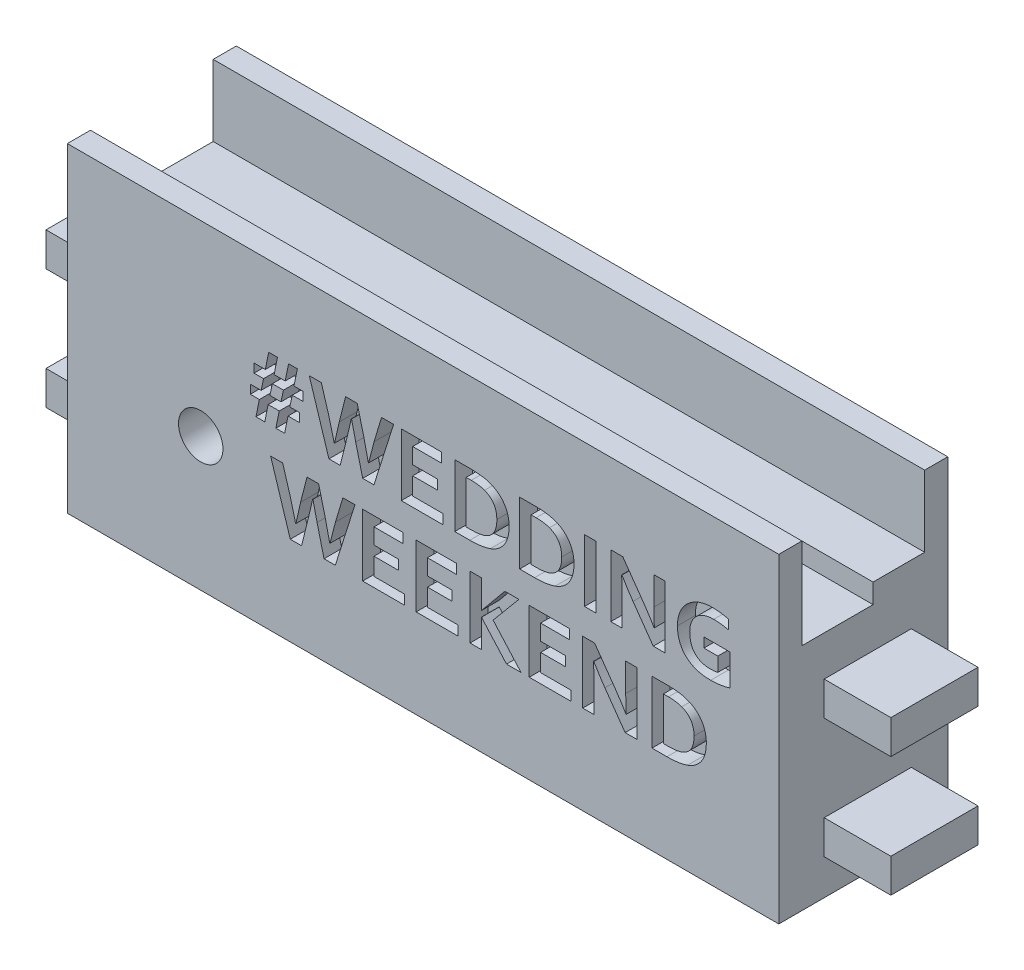
from build123d import *

# Parameters (mm, degrees)
SKETCH1_W              = 101.6
SKETCH1_H              = 35.56
BASE_EXTRUDE_DEPTH     = 24.13
SKETCH2_W              = 12.446
SKETCH2_H              = 4.826
PEG_EXTRUDE_DEPTH      = 9.525
SKETCH3_W              = 101.6
SKETCH3_H              = 3.302
PICTURE_EXTRUDE_DEPTH  = 10.16
SKETCH6_W              = 57.15
SKETCH6_H              = 27.94
SKETCH6_W_2            = 12.7
ELECTRONICS_CUT_DEPTH  = 19.05
SKETCH7_W              = 6.35
SKETCH7_H              = 27.94
BATTERY_WIRE_CUT_DEPTH = 6.35
SWITCH_CUT_REACH       = 123.663
SKETCH8_R              = 3.175
SKETCH9_W              = 3.81
SKETCH9_H              = 6.35
LED_WIRE_CUT_DEPTH     = 12.7
SKETCH10_R             = 1.905
BACK_PLATE_HOLES_DEPTH = 19.05
SKETCH11_W             = 1.627746479
SKETCH11_H             = 8.89
TEXT_CUT_DEPTH         = 2.54
SKETCH12_W             = 101.6
SKETCH12_H             = 10.16
LED_CUT_DEPTH          = 2.794


with BuildPart() as part:
    # Sketch1 → Base Extrude (new body)
    with BuildSketch(Plane.XY):
        with Locations((50.8, 17.78)):
            Rectangle(SKETCH1_W, SKETCH1_H)
    extrude(amount=BASE_EXTRUDE_DEPTH)

    # Sketch2 → Peg Extrude (add)
    with BuildSketch(Plane(origin=(101.6, 0, 0), x_dir=(0, 0, -1), z_dir=(1, 0, 0))):
        with Locations((-11.43, 7.493)):
            Rectangle(SKETCH2_W, SKETCH2_H)
        with Locations((-11.43, 24.638)):
            Rectangle(SKETCH2_W, SKETCH2_H)
    peg_extrude = extrude(amount=PEG_EXTRUDE_DEPTH)

    # Peg Mirror: Peg Extrude across plane
    add(peg_extrude.mirror(Plane(origin=(50.8, 0, 0), x_dir=(0, 0, 1), z_dir=(1, 0, 0))))

    # Sketch3 → Picture Extrude (add)
    with BuildSketch(Plane(origin=(0, 35.56, 0), x_dir=(1, 0, 0), z_dir=(0, 1, 0))):
        with Locations((50.8, -22.479)):
            Rectangle(SKETCH3_W, SKETCH3_H)
        with Locations((50.8, -1.651)):
            Rectangle(SKETCH3_W, SKETCH3_H)
    extrude(amount=PICTURE_EXTRUDE_DEPTH)

    # Sketch6 → Electronics Cut (cut)
    with BuildSketch(Plane(origin=(0, 0, 0), x_dir=(-1, 0, 0), z_dir=(0, 0, -1))):
        with Locations((-60.325, 17.145)):
            Rectangle(SKETCH6_W, SKETCH6_H)
        with Locations((-19.05, 17.145)):
            Rectangle(SKETCH6_W_2, SKETCH6_H)
    extrude(amount=-ELECTRONICS_CUT_DEPTH, mode=Mode.SUBTRACT)

    # Sketch7 → Battery Wire Cut (cut)
    with BuildSketch(Plane(origin=(31.75, 0, 0), x_dir=(0, 0, -1), z_dir=(1, 0, 0))):
        with Locations((-3.175, 17.145)):
            Rectangle(SKETCH7_W, SKETCH7_H)
    extrude(amount=-BATTERY_WIRE_CUT_DEPTH, mode=Mode.SUBTRACT)

    # Sketch8 → Switch Cut (cut, up to next)
    with BuildSketch(Plane(origin=(0, 0, 19.05), x_dir=(-1, 0, 0), z_dir=(0, 0, -1)), mode=Mode.PRIVATE) as switch_cut_sk1:
        with Locations((-19.05, 19.05)):
            Circle(SKETCH8_R)
    switch_cut_tool1 = extrude(switch_cut_sk1.sketch, amount=-SWITCH_CUT_REACH, mode=Mode.PRIVATE) & part.part
    add(switch_cut_tool1.solids().sort_by_distance((19.05, 19.05, 19.05))[0], mode=Mode.SUBTRACT)

    # Sketch9 → LED Wire Cut (cut)
    with BuildSketch(Plane(origin=(0, 35.56, 0), x_dir=(1, 0, 0), z_dir=(0, 1, 0))):
        with Locations((10.795, -17.653)):
            Rectangle(SKETCH9_W, SKETCH9_H)
    extrude(amount=-LED_WIRE_CUT_DEPTH, mode=Mode.SUBTRACT)

    # Sketch10 → Back Plate Holes (cut)
    with BuildSketch(Plane(origin=(0, 0, 0), x_dir=(-1, 0, 0), z_dir=(0, 0, -1))):
        with Locations((-95.25, 22.86)):
            Circle(SKETCH10_R)
        with Locations((-6.35, 22.86)):
            Circle(SKETCH10_R)
    extrude(amount=-BACK_PLATE_HOLES_DEPTH, mode=Mode.SUBTRACT)

    # Sketch11 → Text Cut (cut)
    # profile 1 of 15: a face of its own
    with BuildSketch(Plane.XY.offset(24.13)):
        Polygon((28.272033451, 31.910985915), (28.755270687, 34.29), (30.009339789, 34.29), (29.526102553, 31.910985915), (31.110807658, 31.910985915), (31.594044894, 34.29), (32.848113996, 34.29), (32.366833187, 31.910985915), (33.66003081, 31.910985915), (33.66003081, 30.658873239), (32.114454225, 30.658873239), (31.766210387, 29.031126761), (33.118100792, 29.031126761), (33.118100792, 27.779014085), (31.513831426, 27.779014085), (31.032550616, 25.4), (29.778481514, 25.4), (30.259762324, 27.779014085), (28.675057218, 27.779014085), (28.193776408, 25.4), (26.93775088, 25.4), (27.420988116, 27.779014085), (26.125834067, 27.779014085), (26.125834067, 29.031126761), (27.671410651, 29.031126761), (28.021610915, 30.658873239), (26.667764085, 30.658873239), (26.667764085, 31.910985915), align=None)
        Polygon((28.925479754, 29.031126761), (30.510184859, 29.031126761), (30.860385123, 30.658873239), (29.275680018, 30.658873239), align=None, mode=Mode.SUBTRACT)
    # profile 2 of 15: a face of its own
    with BuildSketch(Plane.XY.offset(24.13)):
        with BuildLine():
            add(Edge.make_bspline(
                [(40.548606954, 31.952070863), (40.459062178, 31.530883449), (40.276556497, 30.672440349), (40.064051291, 29.820923859), (39.955809859, 29.387196303)],
                knots=[0, 0, 0, 0, 0.981282074, 2, 2, 2, 2], degree=3))
            Line((39.955809859, 29.387196303), (38.963901849, 25.4))
            Line((38.963901849, 25.4), (37.353763204, 25.4))
            Line((37.353763204, 25.4), (34.548248239, 34.29))
            Line((34.548248239, 34.29), (36.269903169, 34.29))
            Line((36.269903169, 34.29), (37.334198944, 30.748868838))
            add(Edge.make_bspline(
                [(37.334198944, 30.748868838), (37.411148367, 30.477759151), (37.561094404, 29.949466388), (37.769056066, 29.175770377), (37.951427957, 28.441101025), (38.060109262, 27.963741128), (38.112856514, 27.732059859)],
                knots=[0, 0, 0, 0, 1.085241255, 2.114734843, 3.085007714, 4, 4, 4, 4], degree=3))
            Line((38.112856514, 27.732059859), (38.151985035, 27.732059859))
            add(Edge.make_bspline(
                [(38.151985035, 27.732059859), (38.201400533, 27.974826975), (38.301185712, 28.465048893), (38.466632873, 29.202159359), (38.640317701, 29.949815032), (38.764361907, 30.449688762), (38.826952025, 30.701914613)],
                knots=[0, 0, 0, 0, 0.976034386, 1.970915402, 2.976166265, 4, 4, 4, 4], degree=3))
            Line((38.826952025, 30.701914613), (39.736690141, 34.29))
            Line((39.736690141, 34.29), (41.401608715, 34.29))
            Line((41.401608715, 34.29), (42.313303257, 30.701914613))
            add(Edge.make_bspline(
                [(42.313303257, 30.701914613), (42.436670431, 30.20378983), (42.680738362, 29.218306561), (42.885199908, 28.223853998), (42.98631382, 27.732059859)],
                knots=[0, 0, 0, 0, 1.01092489, 2, 2, 2, 2], degree=3))
            Line((42.98631382, 27.732059859), (43.025442342, 27.732059859))
            add(Edge.make_bspline(
                [(43.025442342, 27.732059859), (43.086635706, 27.994404202), (43.207544224, 28.512755592), (43.399892501, 29.277645717), (43.596566916, 30.021428758), (43.735507753, 30.508441114), (43.804099912, 30.748868838)],
                knots=[0, 0, 0, 0, 1.037391309, 2.04972297, 3.037189381, 4, 4, 4, 4], degree=3))
            Line((43.804099912, 30.748868838), (44.868395687, 34.29))
            Line((44.868395687, 34.29), (46.592007042, 34.29))
            Line((46.592007042, 34.29), (43.784535651, 25.4))
            Line((43.784535651, 25.4), (42.174397007, 25.4))
            Line((42.174397007, 25.4), (41.182488996, 29.387196303))
            add(Edge.make_bspline(
                [(41.182488996, 29.387196303), (41.128168799, 29.608877134), (41.020880976, 30.046718951), (40.865379003, 30.695749771), (40.723064933, 31.329286678), (40.633700472, 31.746573235), (40.589691901, 31.952070863)],
                knots=[0, 0, 0, 0, 1.040356569, 2.054808294, 3.042067674, 4, 4, 4, 4], degree=3))
            Line((40.589691901, 31.952070863), (40.548606954, 31.952070863))
        make_face()
    # profile 3 of 15: a face of its own
    with BuildSketch(Plane.XY.offset(24.13)):
        Polygon((49.315352113, 26.777323944), (53.660574384, 26.777323944), (53.660574384, 25.4), (47.687605634, 25.4), (47.687605634, 34.29), (53.421890405, 34.29), (53.421890405, 32.912676056), (49.315352113, 32.912676056), (49.315352113, 30.658873239), (52.840831866, 30.658873239), (52.840831866, 29.281549296), (49.315352113, 29.281549296), align=None)
    # profile 4 of 15: a face of its own
    with BuildSketch(Plane.XY.offset(24.13)):
        with BuildLine():
            Line((55.325492958, 25.4), (55.325492958, 34.29))
            Line((55.325492958, 34.29), (57.712332746, 34.29))
            add(Edge.make_bspline(
                [(57.712332746, 34.29), (57.818653505, 34.289540009), (58.033369354, 34.288611053), (58.356288005, 34.271657216), (58.677393425, 34.247443495), (58.991691758, 34.211210536), (59.29664915, 34.169200223), (59.589704801, 34.116636732), (59.867421074, 34.056479265), (60.043392058, 34.002893986), (60.128518926, 33.976971831)],
                knots=[0, 0, 0, 0, 1.043593946, 2.10754854, 3.173523578, 4.204294749, 5.212878915, 6.194903184, 7.126775134, 8, 8, 8, 8], degree=3))
            add(Edge.make_bspline(
                [(60.128518926, 33.976971831), (60.245791136, 33.937384116), (60.476019212, 33.859665758), (60.807079277, 33.719215567), (61.114084505, 33.55300963), (61.403152303, 33.371918927), (61.669544262, 33.170202396), (61.913204304, 32.949815332), (62.135463663, 32.713035698), (62.332932524, 32.45720373), (62.510045504, 32.186958349), (62.662532354, 31.900526562), (62.792453027, 31.598779433), (62.899736772, 31.282157667), (62.983940868, 30.950477634), (63.043935839, 30.605164987), (63.082673077, 30.24629877), (63.086597356, 30.002267931), (63.088591549, 29.878259243)],
                knots=[0, 0, 0, 0, 1.089186224, 2.138283641, 3.160292024, 4.158706084, 5.137912795, 6.096978333, 7.047244128, 7.992138446, 8.937782078, 9.887874514, 10.844274186, 11.826235823, 12.827154491, 13.85289531, 14.908909893, 16, 16, 16, 16], degree=3))
            add(Edge.make_bspline(
                [(63.088591549, 29.878259243), (63.086992329, 29.760140691), (63.083849841, 29.528036136), (63.050639285, 29.18513348), (63.001058536, 28.85366959), (62.929913566, 28.533559401), (62.841497906, 28.225209899), (62.726623053, 27.931681136), (62.593888301, 27.650467584), (62.439254439, 27.383749272), (62.261871829, 27.13226347), (62.064174033, 26.894850204), (61.843986948, 26.67326125), (61.602960938, 26.467227964), (61.338458677, 26.278207814), (61.051311074, 26.106723277), (60.740567905, 25.952789673), (60.521824923, 25.86786465), (60.410244278, 25.824544454)],
                knots=[0, 0, 0, 0, 1.086887555, 2.135748769, 3.168058729, 4.170063808, 5.152092151, 6.117449806, 7.067931046, 8.012022167, 8.951272991, 9.89736566, 10.852385093, 11.823139696, 12.812606439, 13.84101728, 14.898704396, 16, 16, 16, 16], degree=3))
            add(Edge.make_bspline(
                [(60.410244278, 25.824544454), (60.31217373, 25.790012137), (60.11080917, 25.719108231), (59.79396908, 25.635006684), (59.45825222, 25.562792778), (59.103269743, 25.50202379), (58.727332948, 25.454583262), (58.328269765, 25.425827232), (57.906956372, 25.401852326), (57.617811128, 25.400627335), (57.469735915, 25.4)],
                knots=[0, 0, 0, 0, 0.835398993, 1.715293255, 2.632340385, 3.594875658, 4.609085711, 5.676420896, 6.810063539, 8, 8, 8, 8], degree=3))
            Line((57.469735915, 25.4), (55.325492958, 25.4))
        make_face()
        with BuildLine():
            add(Edge.make_bspline(
                [(57.630162852, 26.777323944), (57.746915173, 26.778438568), (57.974038036, 26.780606892), (58.305064366, 26.797712437), (58.616404246, 26.829130228), (58.908296141, 26.87178806), (59.180263044, 26.925691319), (59.432203859, 26.993029031), (59.666237558, 27.068960216), (59.811441112, 27.134702392), (59.882009243, 27.166652729)],
                knots=[0, 0, 0, 0, 1.216660131, 2.36681661, 3.452842549, 4.476429291, 5.440052605, 6.340109689, 7.193302415, 8, 8, 8, 8], degree=3))
            add(Edge.make_bspline(
                [(59.882009243, 27.166652729), (59.940643662, 27.19625228), (60.05664863, 27.254813359), (60.21813768, 27.359830281), (60.370974749, 27.472149411), (60.512565289, 27.594169299), (60.643508541, 27.726923156), (60.762037421, 27.869326412), (60.870912292, 28.021488776), (60.96861128, 28.183612878), (61.055147441, 28.357777346), (61.13167101, 28.542395305), (61.193191811, 28.739973326), (61.247405535, 28.947164537), (61.28478959, 29.16730998), (61.314732775, 29.398262493), (61.332399028, 29.641257794), (61.334539532, 29.807147767), (61.335633803, 29.891954225)],
                knots=[0, 0, 0, 0, 0.961643136, 1.902557943, 2.817899626, 3.739205806, 4.637788669, 5.546725084, 6.450827767, 7.376631405, 8.316672613, 9.297862575, 10.30104246, 11.346161031, 12.433195875, 13.569702801, 14.75758074, 16, 16, 16, 16], degree=3))
            add(Edge.make_bspline(
                [(61.335633803, 29.891954225), (61.333931714, 29.980021523), (61.330597999, 30.15251036), (61.310449991, 30.404495754), (61.269981685, 30.642743858), (61.218089533, 30.867871818), (61.150701047, 31.080844363), (61.071428774, 31.282145093), (60.976879442, 31.471179477), (60.86893493, 31.647479397), (60.749160131, 31.812246329), (60.618462147, 31.966226139), (60.471729099, 32.104830376), (60.315573825, 32.23461473), (60.146978051, 32.351769504), (59.967883211, 32.457087361), (59.779959584, 32.554653888), (59.64772029, 32.607890549), (59.58071963, 32.634863556)],
                knots=[0, 0, 0, 0, 1.211129113, 2.372120613, 3.47189722, 4.531188705, 5.546525523, 6.540652967, 7.503134403, 8.448971039, 9.379896832, 10.301969689, 11.221597421, 12.151615773, 13.091952693, 14.040845077, 15.007370132, 16, 16, 16, 16], degree=3))
            add(Edge.make_bspline(
                [(59.58071963, 32.634863556), (59.446596841, 32.67981635), (59.16812447, 32.773149565), (58.798587628, 32.839149204), (58.48235872, 32.877503403), (58.2265586, 32.899188115), (57.95633933, 32.910420206), (57.771687497, 32.911912017), (57.677117077, 32.912676056)],
                knots=[0, 0, 0, 0, 1.315300483, 2.730891928, 3.483105346, 4.281150212, 5.119681927, 6, 6, 6, 6], degree=3))
            Line((57.677117077, 32.912676056), (56.953239437, 32.912676056))
            Line((56.953239437, 32.912676056), (56.953239437, 26.777323944))
            Line((56.953239437, 26.777323944), (57.630162852, 26.777323944))
        make_face(mode=Mode.SUBTRACT)
    # profile 5 of 15: a face of its own
    with BuildSketch(Plane.XY.offset(24.13)):
        with BuildLine():
            Line((64.591126761, 25.4), (64.591126761, 34.29))
            Line((64.591126761, 34.29), (66.977966549, 34.29))
            add(Edge.make_bspline(
                [(66.977966549, 34.29), (67.084287308, 34.289540009), (67.299003156, 34.288611053), (67.621921808, 34.271657216), (67.943027228, 34.247443495), (68.257325561, 34.211210536), (68.562282953, 34.169200223), (68.855338604, 34.116636732), (69.133054877, 34.056479265), (69.309025861, 34.002893986), (69.394152729, 33.976971831)],
                knots=[0, 0, 0, 0, 1.043593946, 2.10754854, 3.173523578, 4.204294749, 5.212878915, 6.194903184, 7.126775134, 8, 8, 8, 8], degree=3))
            add(Edge.make_bspline(
                [(69.394152729, 33.976971831), (69.511424939, 33.937384116), (69.741653015, 33.859665758), (70.07271308, 33.719215567), (70.379718308, 33.55300963), (70.668786106, 33.371918927), (70.935178064, 33.170202396), (71.178838107, 32.949815332), (71.401097466, 32.713035698), (71.598566327, 32.45720373), (71.775679307, 32.186958349), (71.928166157, 31.900526562), (72.05808683, 31.598779433), (72.165370575, 31.282157667), (72.24957467, 30.950477634), (72.309569642, 30.605164987), (72.34830688, 30.24629877), (72.352231159, 30.002267931), (72.354225352, 29.878259243)],
                knots=[0, 0, 0, 0, 1.089186224, 2.138283641, 3.160292024, 4.158706084, 5.137912795, 6.096978333, 7.047244128, 7.992138446, 8.937782078, 9.887874514, 10.844274186, 11.826235823, 12.827154491, 13.85289531, 14.908909893, 16, 16, 16, 16], degree=3))
            add(Edge.make_bspline(
                [(72.354225352, 29.878259243), (72.352626132, 29.760140691), (72.349483644, 29.528036136), (72.316273088, 29.18513348), (72.266692339, 28.85366959), (72.195547369, 28.533559401), (72.107131709, 28.225209899), (71.992256856, 27.931681136), (71.859522104, 27.650467584), (71.704888241, 27.383749272), (71.527505632, 27.13226347), (71.329807836, 26.894850204), (71.109620751, 26.67326125), (70.868594741, 26.467227964), (70.60409248, 26.278207814), (70.316944876, 26.106723277), (70.006201708, 25.952789673), (69.787458726, 25.86786465), (69.675878081, 25.824544454)],
                knots=[0, 0, 0, 0, 1.086887555, 2.135748769, 3.168058729, 4.170063808, 5.152092151, 6.117449806, 7.067931046, 8.012022167, 8.951272991, 9.89736566, 10.852385093, 11.823139696, 12.812606439, 13.84101728, 14.898704396, 16, 16, 16, 16], degree=3))
            add(Edge.make_bspline(
                [(69.675878081, 25.824544454), (69.577807533, 25.790012137), (69.376442973, 25.719108231), (69.059602882, 25.635006684), (68.723886023, 25.562792778), (68.368903545, 25.50202379), (67.99296675, 25.454583262), (67.593903568, 25.425827232), (67.172590174, 25.401852326), (66.88344493, 25.400627335), (66.735369718, 25.4)],
                knots=[0, 0, 0, 0, 0.835398993, 1.715293255, 2.632340385, 3.594875658, 4.609085711, 5.676420896, 6.810063539, 8, 8, 8, 8], degree=3))
            Line((66.735369718, 25.4), (64.591126761, 25.4))
        make_face()
        with BuildLine():
            add(Edge.make_bspline(
                [(66.895796655, 26.777323944), (67.012548976, 26.778438568), (67.239671839, 26.780606892), (67.570698169, 26.797712437), (67.882038049, 26.829130228), (68.173929943, 26.87178806), (68.445896846, 26.925691319), (68.697837662, 26.993029031), (68.931871361, 27.068960216), (69.077074915, 27.134702392), (69.147643046, 27.166652729)],
                knots=[0, 0, 0, 0, 1.216660131, 2.36681661, 3.452842549, 4.476429291, 5.440052605, 6.340109689, 7.193302415, 8, 8, 8, 8], degree=3))
            add(Edge.make_bspline(
                [(69.147643046, 27.166652729), (69.206277465, 27.19625228), (69.322282432, 27.254813359), (69.483771483, 27.359830281), (69.636608551, 27.472149411), (69.778199092, 27.594169299), (69.909142344, 27.726923156), (70.027671224, 27.869326412), (70.136546095, 28.021488776), (70.234245082, 28.183612878), (70.320781243, 28.357777346), (70.397304813, 28.542395305), (70.458825614, 28.739973326), (70.513039338, 28.947164537), (70.550423393, 29.16730998), (70.580366578, 29.398262493), (70.598032831, 29.641257794), (70.600173335, 29.807147767), (70.601267606, 29.891954225)],
                knots=[0, 0, 0, 0, 0.961643136, 1.902557943, 2.817899626, 3.739205806, 4.637788669, 5.546725084, 6.450827767, 7.376631405, 8.316672613, 9.297862575, 10.30104246, 11.346161031, 12.433195875, 13.569702801, 14.75758074, 16, 16, 16, 16], degree=3))
            add(Edge.make_bspline(
                [(70.601267606, 29.891954225), (70.599565517, 29.980021523), (70.596231802, 30.15251036), (70.576083794, 30.404495754), (70.535615488, 30.642743858), (70.483723335, 30.867871818), (70.41633485, 31.080844363), (70.337062577, 31.282145093), (70.242513245, 31.471179477), (70.134568733, 31.647479397), (70.014793934, 31.812246329), (69.88409595, 31.966226139), (69.737362902, 32.104830376), (69.581207628, 32.23461473), (69.412611854, 32.351769504), (69.233517014, 32.457087361), (69.045593387, 32.554653888), (68.913354093, 32.607890549), (68.846353433, 32.634863556)],
                knots=[0, 0, 0, 0, 1.211129113, 2.372120613, 3.47189722, 4.531188705, 5.546525523, 6.540652967, 7.503134403, 8.448971039, 9.379896832, 10.301969689, 11.221597421, 12.151615773, 13.091952693, 14.040845077, 15.007370132, 16, 16, 16, 16], degree=3))
            add(Edge.make_bspline(
                [(68.846353433, 32.634863556), (68.712230643, 32.67981635), (68.433758272, 32.773149565), (68.064221431, 32.839149204), (67.747992523, 32.877503403), (67.492192402, 32.899188115), (67.221973132, 32.910420206), (67.0373213, 32.911912017), (66.94275088, 32.912676056)],
                knots=[0, 0, 0, 0, 1.315300483, 2.730891928, 3.483105346, 4.281150212, 5.119681927, 6, 6, 6, 6], degree=3))
            Line((66.94275088, 32.912676056), (66.218873239, 32.912676056))
            Line((66.218873239, 32.912676056), (66.218873239, 26.777323944))
            Line((66.218873239, 26.777323944), (66.895796655, 26.777323944))
        make_face(mode=Mode.SUBTRACT)
    # profile 6 of 15: a face of its own
    with BuildSketch(Plane.XY.offset(24.13)):
        with Locations((74.670633803, 29.845)):
            Rectangle(SKETCH11_W, SKETCH11_H)
    # profile 7 of 15: a face of its own
    with BuildSketch(Plane.XY.offset(24.13)):
        with BuildLine():
            add(Edge.make_bspline(
                [(82.236133363, 30.156071743), (82.313707535, 30.043883995), (82.465971125, 29.823680429), (82.690766249, 29.499667215), (82.899037699, 29.181753797), (83.098682053, 28.874656292), (83.289084823, 28.578461272), (83.465136867, 28.289344145), (83.631124027, 28.011050988), (83.736314564, 27.827421204), (83.787579225, 27.737929137)],
                knots=[0, 0, 0, 0, 1.13896322, 2.235571772, 3.292817263, 4.312366223, 5.294281487, 6.232900844, 7.138803343, 8, 8, 8, 8], degree=3))
            Line((83.787579225, 27.737929137), (83.826707746, 27.737929137))
            add(Edge.make_bspline(
                [(83.826707746, 27.737929137), (83.820789531, 27.877485433), (83.809368348, 28.146806158), (83.79364975, 28.536133811), (83.780153297, 28.896122827), (83.76758645, 29.226715761), (83.760322807, 29.528047706), (83.754310204, 29.799336527), (83.750161864, 30.041283772), (83.748997655, 30.192590498), (83.748450704, 30.263675176)],
                knots=[0, 0, 0, 0, 1.326562248, 2.560047207, 3.700459796, 4.747806249, 5.701913724, 6.562998787, 7.324889438, 8, 8, 8, 8], degree=3))
            Line((83.748450704, 30.263675176), (83.748450704, 34.29))
            Line((83.748450704, 34.29), (85.376197183, 34.29))
            Line((85.376197183, 34.29), (85.376197183, 25.4))
            Line((85.376197183, 25.4), (83.672150088, 25.4))
            Line((83.672150088, 25.4), (80.780552377, 29.49284331))
            add(Edge.make_bspline(
                [(80.780552377, 29.49284331), (80.65087482, 29.675925448), (80.38370492, 30.053122843), (79.995734797, 30.650387217), (79.596207147, 31.287307148), (79.335607655, 31.730325608), (79.201716549, 31.957940141)],
                knots=[0, 0, 0, 0, 0.919269384, 1.893936901, 2.917944486, 4, 4, 4, 4], degree=3))
            Line((79.201716549, 31.957940141), (79.160631602, 31.957940141))
            add(Edge.make_bspline(
                [(79.160631602, 31.957940141), (79.16739658, 31.825566575), (79.1805245, 31.568686255), (79.195613625, 31.194949655), (79.209326252, 30.844099553), (79.221791005, 30.516109956), (79.229042885, 30.210864259), (79.235083192, 29.929140974), (79.239178664, 29.670236446), (79.240305954, 29.505235162), (79.24084507, 29.426324824)],
                knots=[0, 0, 0, 0, 1.255808074, 2.436984887, 3.543827291, 4.582519822, 5.546722309, 6.436656003, 7.252345191, 8, 8, 8, 8], degree=3))
            Line((79.24084507, 29.426324824), (79.24084507, 25.4))
            Line((79.24084507, 25.4), (77.613098592, 25.4))
            Line((77.613098592, 25.4), (77.613098592, 34.29))
            Line((77.613098592, 34.29), (79.317145687, 34.29))
            Line((79.317145687, 34.29), (82.236133363, 30.156071743))
        make_face()
    # profile 8 of 15: a face of its own
    with BuildSketch(Plane.XY.offset(24.13)):
        with BuildLine():
            Line((92.888873239, 28.780704225), (90.90897007, 28.780704225))
            Line((90.90897007, 28.780704225), (90.90897007, 30.158028169))
            Line((90.90897007, 30.158028169), (94.641830986, 30.158028169))
            Line((94.641830986, 30.158028169), (94.641830986, 25.709115317))
            add(Edge.make_bspline(
                [(94.641830986, 25.709115317), (94.567045756, 25.683664878), (94.400573047, 25.627011932), (94.123828784, 25.550802171), (93.800850779, 25.47702105), (93.442261231, 25.412628528), (93.05992699, 25.356315193), (92.665284286, 25.311497716), (92.266565426, 25.280398947), (92.000060453, 25.276651202), (91.867618838, 25.274788732)],
                knots=[0, 0, 0, 0, 0.672392139, 1.496751972, 2.442164542, 3.4918823, 4.597344684, 5.731540891, 6.872672486, 8, 8, 8, 8], degree=3))
            add(Edge.make_bspline(
                [(91.867618838, 25.274788732), (91.675716136, 25.278145248), (91.30263185, 25.28467076), (90.76211955, 25.346440874), (90.258413993, 25.444951281), (89.792821628, 25.583146667), (89.365586498, 25.760689222), (88.974837181, 25.969295714), (88.620868353, 26.211798068), (88.304981591, 26.486678088), (88.025450965, 26.79082394), (87.785018204, 27.125098662), (87.581234917, 27.486051188), (87.41467348, 27.873829469), (87.28499452, 28.285439272), (87.197934151, 28.719848765), (87.137412727, 29.173555516), (87.131943432, 29.483504961), (87.12915493, 29.64153169)],
                knots=[0, 0, 0, 0, 1.259439321, 2.448516959, 3.566075659, 4.625305067, 5.631089946, 6.598424526, 7.528272133, 8.441722042, 9.341708401, 10.234086166, 11.138977727, 12.057560289, 12.999997922, 13.966450983, 14.96320156, 16, 16, 16, 16], degree=3))
            add(Edge.make_bspline(
                [(87.12915493, 29.64153169), (87.130815914, 29.754431399), (87.134106054, 29.978067352), (87.167004688, 30.309279917), (87.217323832, 30.632785686), (87.287981511, 30.947735468), (87.376637511, 31.253813571), (87.490691573, 31.546949981), (87.615304179, 31.83219804), (87.766059979, 32.102092545), (87.932255092, 32.361193007), (88.116281402, 32.607389265), (88.316107696, 32.84091316), (88.53258822, 33.060323056), (88.761687004, 33.267263933), (89.006442205, 33.457456061), (89.26199315, 33.634540474), (89.533048945, 33.792159318), (89.815258199, 33.935990511), (90.111077784, 34.061844898), (90.421206892, 34.165908287), (90.742523559, 34.257462451), (91.077350946, 34.32718956), (91.424898427, 34.377768533), (91.784178134, 34.410243386), (92.027975908, 34.413542444), (92.151300616, 34.415211268)],
                knots=[0, 0, 0, 0, 1.046947054, 2.07383177, 3.084264002, 4.08223388, 5.066078611, 6.036761759, 6.997993267, 7.951004885, 8.900727893, 9.851663817, 10.799767188, 11.749393866, 12.708910759, 13.661250194, 14.622691056, 15.590656151, 16.567277404, 17.559363192, 18.569415095, 19.599768335, 20.656854749, 21.739051492, 22.856302868, 24, 24, 24, 24], degree=3))
            add(Edge.make_bspline(
                [(92.151300616, 34.415211268), (92.368648964, 34.410826957), (92.792728156, 34.402272511), (93.31147019, 34.343437883), (93.697685694, 34.277403254), (93.957652465, 34.225063312), (94.19025344, 34.167412846), (94.334868662, 34.121774344), (94.403147007, 34.100226673)],
                knots=[0, 0, 0, 0, 1.713943171, 3.344159923, 4.111131344, 4.804149456, 5.435393488, 6, 6, 6, 6], degree=3))
            Line((94.403147007, 34.100226673), (94.403147007, 32.787464789))
            add(Edge.make_bspline(
                [(94.403147007, 32.787464789), (94.231382991, 32.825486795), (93.887026726, 32.901714147), (93.363333729, 32.977077657), (92.835166364, 33.029727782), (92.481415872, 33.035160936), (92.303901849, 33.037887324)],
                knots=[0, 0, 0, 0, 0.996084155, 1.996971345, 2.994868747, 4, 4, 4, 4], degree=3))
            add(Edge.make_bspline(
                [(92.303901849, 33.037887324), (92.185755922, 33.035171398), (91.952722824, 33.02981446), (91.608486911, 32.989804911), (91.275773322, 32.924121687), (90.956501244, 32.829712714), (90.65323958, 32.711546635), (90.369824664, 32.566302639), (90.107854913, 32.394725206), (89.866792639, 32.199160852), (89.647840942, 31.978542592), (89.453600152, 31.733121157), (89.284634321, 31.462395523), (89.139355893, 31.168841851), (89.022977422, 30.85035851), (88.942289935, 30.506871493), (88.889442187, 30.14075677), (88.88459494, 29.888233736), (88.882112676, 29.758917254)],
                knots=[0, 0, 0, 0, 1.061206999, 2.09314329, 3.108836576, 4.10434043, 5.080222147, 6.028743409, 6.959843716, 7.888563279, 8.812391495, 9.746583211, 10.694253707, 11.674171854, 12.684256855, 13.73293748, 14.839042339, 16, 16, 16, 16], degree=3))
            add(Edge.make_bspline(
                [(88.882112676, 29.758917254), (88.884845219, 29.633602337), (88.890152042, 29.390230439), (88.928116051, 29.037140656), (88.986802334, 28.707389772), (89.073683267, 28.403265588), (89.181112951, 28.122031397), (89.313629273, 27.864457698), (89.473279778, 27.632855405), (89.654618073, 27.424711906), (89.859502569, 27.243052484), (90.083501231, 27.082439571), (90.329749822, 26.950613638), (90.593825294, 26.839202186), (90.879644148, 26.756002903), (91.18479592, 26.696415583), (91.509911516, 26.657730594), (91.733162919, 26.654021489), (91.848054577, 26.652112676)],
                knots=[0, 0, 0, 0, 1.226148292, 2.381281054, 3.471548827, 4.499835092, 5.471674122, 6.413633357, 7.327055027, 8.217994302, 9.108384828, 10.000877058, 10.909021892, 11.835877768, 12.801093484, 13.816144422, 14.876124474, 16, 16, 16, 16], degree=3))
            add(Edge.make_bspline(
                [(91.848054577, 26.652112676), (91.937440203, 26.653810558), (92.119711684, 26.657272809), (92.389939559, 26.679311776), (92.648009078, 26.710337073), (92.812049064, 26.741301714), (92.888873239, 26.755803257)],
                knots=[0, 0, 0, 0, 1.023962254, 2.088021609, 3.104570984, 4, 4, 4, 4], degree=3))
            Line((92.888873239, 26.755803257), (92.888873239, 28.780704225))
        make_face()
    # profile 9 of 15: a face of its own
    with BuildSketch(Plane.XY.offset(24.13)):
        with BuildLine():
            add(Edge.make_bspline(
                [(35.030367518, 19.252070863), (34.940822741, 18.830883449), (34.758317061, 17.972440349), (34.545811854, 17.120923859), (34.437570423, 16.687196303)],
                knots=[0, 0, 0, 0, 0.981282074, 2, 2, 2, 2], degree=3))
            Line((34.437570423, 16.687196303), (33.445662412, 12.7))
            Line((33.445662412, 12.7), (31.835523768, 12.7))
            Line((31.835523768, 12.7), (29.030008803, 21.59))
            Line((29.030008803, 21.59), (30.751663732, 21.59))
            Line((30.751663732, 21.59), (31.815959507, 18.048868838))
            add(Edge.make_bspline(
                [(31.815959507, 18.048868838), (31.89290893, 17.777759151), (32.042854968, 17.249466388), (32.25081663, 16.475770377), (32.43318852, 15.741101025), (32.541869826, 15.263741128), (32.594617077, 15.032059859)],
                knots=[0, 0, 0, 0, 1.085241255, 2.114734843, 3.085007714, 4, 4, 4, 4], degree=3))
            Line((32.594617077, 15.032059859), (32.633745599, 15.032059859))
            add(Edge.make_bspline(
                [(32.633745599, 15.032059859), (32.683161097, 15.274826975), (32.782946276, 15.765048893), (32.948393436, 16.502159359), (33.122078265, 17.249815032), (33.246122471, 17.749688762), (33.308712588, 18.001914613)],
                knots=[0, 0, 0, 0, 0.976034386, 1.970915402, 2.976166265, 4, 4, 4, 4], degree=3))
            Line((33.308712588, 18.001914613), (34.218450704, 21.59))
            Line((34.218450704, 21.59), (35.883369278, 21.59))
            Line((35.883369278, 21.59), (36.79506382, 18.001914613))
            add(Edge.make_bspline(
                [(36.79506382, 18.001914613), (36.918430994, 17.50378983), (37.162498926, 16.518306561), (37.366960471, 15.523853998), (37.468074384, 15.032059859)],
                knots=[0, 0, 0, 0, 1.01092489, 2, 2, 2, 2], degree=3))
            Line((37.468074384, 15.032059859), (37.507202905, 15.032059859))
            add(Edge.make_bspline(
                [(37.507202905, 15.032059859), (37.56839627, 15.294404202), (37.689304787, 15.812755592), (37.881653064, 16.577645717), (38.07832748, 17.321428758), (38.217268316, 17.808441114), (38.285860475, 18.048868838)],
                knots=[0, 0, 0, 0, 1.037391309, 2.04972297, 3.037189381, 4, 4, 4, 4], degree=3))
            Line((38.285860475, 18.048868838), (39.35015625, 21.59))
            Line((39.35015625, 21.59), (41.073767606, 21.59))
            Line((41.073767606, 21.59), (38.266296215, 12.7))
            Line((38.266296215, 12.7), (36.65615757, 12.7))
            Line((36.65615757, 12.7), (35.66424956, 16.687196303))
            add(Edge.make_bspline(
                [(35.66424956, 16.687196303), (35.609929363, 16.908877134), (35.502641539, 17.346718951), (35.347139567, 17.995749771), (35.204825496, 18.629286678), (35.115461035, 19.046573235), (35.071452465, 19.252070863)],
                knots=[0, 0, 0, 0, 1.040356569, 2.054808294, 3.042067674, 4, 4, 4, 4], degree=3))
            Line((35.071452465, 19.252070863), (35.030367518, 19.252070863))
        make_face()
    # profile 10 of 15: a face of its own
    with BuildSketch(Plane.XY.offset(24.13)):
        Polygon((43.797112676, 14.077323944), (48.142334947, 14.077323944), (48.142334947, 12.7), (42.169366197, 12.7), (42.169366197, 21.59), (47.903650968, 21.59), (47.903650968, 20.212676056), (43.797112676, 20.212676056), (43.797112676, 17.958873239), (47.32259243, 17.958873239), (47.32259243, 16.581549296), (43.797112676, 16.581549296), align=None)
    # profile 11 of 15: a face of its own
    with BuildSketch(Plane.XY.offset(24.13)):
        Polygon((51.435, 14.077323944), (55.780222271, 14.077323944), (55.780222271, 12.7), (49.807253521, 12.7), (49.807253521, 21.59), (55.541538292, 21.59), (55.541538292, 20.212676056), (51.435, 20.212676056), (51.435, 17.958873239), (54.960479754, 17.958873239), (54.960479754, 16.581549296), (51.435, 16.581549296), align=None)
    # profile 12 of 15: a face of its own
    with BuildSketch(Plane.XY.offset(24.13)):
        Polygon((57.499920775, 12.7), (57.499920775, 21.59), (59.117885123, 21.59), (59.117885123, 17.544110915), (59.143318662, 17.544110915), (62.479025088, 21.59), (64.486318222, 21.59), (60.802367958, 17.184128521), (64.789564261, 12.7), (62.715752641, 12.7), (59.143318662, 16.712629842), (59.117885123, 16.712629842), (59.117885123, 12.7), align=None)
    # profile 13 of 15: a face of its own
    with BuildSketch(Plane.XY.offset(24.13)):
        Polygon((67.587253521, 14.077323944), (71.932475792, 14.077323944), (71.932475792, 12.7), (65.959507042, 12.7), (65.959507042, 21.59), (71.693791813, 21.59), (71.693791813, 20.212676056), (67.587253521, 20.212676056), (67.587253521, 17.958873239), (71.112733275, 17.958873239), (71.112733275, 16.581549296), (67.587253521, 16.581549296), align=None)
    # profile 14 of 15: a face of its own
    with BuildSketch(Plane.XY.offset(24.13)):
        with BuildLine():
            add(Edge.make_bspline(
                [(78.220429137, 17.456071743), (78.298003309, 17.343883995), (78.4502669, 17.123680429), (78.675062023, 16.799667215), (78.883333474, 16.481753797), (79.082977827, 16.174656292), (79.273380598, 15.878461272), (79.449432642, 15.589344145), (79.615419801, 15.311050988), (79.720610339, 15.127421204), (79.771875, 15.037929137)],
                knots=[0, 0, 0, 0, 1.13896322, 2.235571772, 3.292817263, 4.312366223, 5.294281487, 6.232900844, 7.138803343, 8, 8, 8, 8], degree=3))
            Line((79.771875, 15.037929137), (79.811003521, 15.037929137))
            add(Edge.make_bspline(
                [(79.811003521, 15.037929137), (79.805085306, 15.177485433), (79.793664123, 15.446806158), (79.777945525, 15.836133811), (79.764449072, 16.196122827), (79.751882225, 16.526715761), (79.744618582, 16.828047706), (79.738605978, 17.099336527), (79.734457638, 17.341283772), (79.73329343, 17.492590498), (79.732746479, 17.563675176)],
                knots=[0, 0, 0, 0, 1.326562248, 2.560047207, 3.700459796, 4.747806249, 5.701913724, 6.562998787, 7.324889438, 8, 8, 8, 8], degree=3))
            Line((79.732746479, 17.563675176), (79.732746479, 21.59))
            Line((79.732746479, 21.59), (81.360492958, 21.59))
            Line((81.360492958, 21.59), (81.360492958, 12.7))
            Line((81.360492958, 12.7), (79.656445863, 12.7))
            Line((79.656445863, 12.7), (76.764848151, 16.79284331))
            add(Edge.make_bspline(
                [(76.764848151, 16.79284331), (76.635170595, 16.975925448), (76.368000695, 17.353122843), (75.980030571, 17.950387217), (75.580502921, 18.587307148), (75.31990343, 19.030325608), (75.186012324, 19.257940141)],
                knots=[0, 0, 0, 0, 0.919269384, 1.893936901, 2.917944486, 4, 4, 4, 4], degree=3))
            Line((75.186012324, 19.257940141), (75.144927377, 19.257940141))
            add(Edge.make_bspline(
                [(75.144927377, 19.257940141), (75.151692354, 19.125566575), (75.164820274, 18.868686255), (75.1799094, 18.494949655), (75.193622027, 18.144099553), (75.20608678, 17.816109956), (75.213338659, 17.510864259), (75.219378967, 17.229140974), (75.223474438, 16.970236446), (75.224601729, 16.805235162), (75.225140845, 16.726324824)],
                knots=[0, 0, 0, 0, 1.255808074, 2.436984887, 3.543827291, 4.582519822, 5.546722309, 6.436656003, 7.252345191, 8, 8, 8, 8], degree=3))
            Line((75.225140845, 16.726324824), (75.225140845, 12.7))
            Line((75.225140845, 12.7), (73.597394366, 12.7))
            Line((73.597394366, 12.7), (73.597394366, 21.59))
            Line((73.597394366, 21.59), (75.301441461, 21.59))
            Line((75.301441461, 21.59), (78.220429137, 17.456071743))
        make_face()
    # profile 15 of 15: a face of its own
    with BuildSketch(Plane.XY.offset(24.13)):
        with BuildLine():
            Line((83.489084507, 12.7), (83.489084507, 21.59))
            Line((83.489084507, 21.59), (85.875924296, 21.59))
            add(Edge.make_bspline(
                [(85.875924296, 21.59), (85.982245054, 21.589540009), (86.196960903, 21.588611053), (86.519879555, 21.571657216), (86.840984975, 21.547443495), (87.155283308, 21.511210536), (87.460240699, 21.469200223), (87.75329635, 21.416636732), (88.031012624, 21.356479265), (88.206983607, 21.302893986), (88.292110475, 21.276971831)],
                knots=[0, 0, 0, 0, 1.043593946, 2.10754854, 3.173523578, 4.204294749, 5.212878915, 6.194903184, 7.126775134, 8, 8, 8, 8], degree=3))
            add(Edge.make_bspline(
                [(88.292110475, 21.276971831), (88.409382686, 21.237384116), (88.639610762, 21.159665758), (88.970670826, 21.019215567), (89.277676055, 20.85300963), (89.566743852, 20.671918927), (89.833135811, 20.470202396), (90.076795853, 20.249815332), (90.299055212, 20.013035698), (90.496524073, 19.75720373), (90.673637053, 19.486958349), (90.826123903, 19.200526562), (90.956044576, 18.898779433), (91.063328322, 18.582157667), (91.147532417, 18.250477634), (91.207527388, 17.905164987), (91.246264627, 17.54629877), (91.250188905, 17.302267931), (91.252183099, 17.178259243)],
                knots=[0, 0, 0, 0, 1.089186224, 2.138283641, 3.160292024, 4.158706084, 5.137912795, 6.096978333, 7.047244128, 7.992138446, 8.937782078, 9.887874514, 10.844274186, 11.826235823, 12.827154491, 13.85289531, 14.908909893, 16, 16, 16, 16], degree=3))
            add(Edge.make_bspline(
                [(91.252183099, 17.178259243), (91.250583879, 17.060140691), (91.24744139, 16.828036136), (91.214230834, 16.48513348), (91.164650086, 16.15366959), (91.093505115, 15.833559401), (91.005089456, 15.525209899), (90.890214603, 15.231681136), (90.757479851, 14.950467584), (90.602845988, 14.683749272), (90.425463378, 14.43226347), (90.227765583, 14.194850204), (90.007578498, 13.97326125), (89.766552487, 13.767227964), (89.502050227, 13.578207814), (89.214902623, 13.406723277), (88.904159454, 13.252789673), (88.685416472, 13.16786465), (88.573835827, 13.124544454)],
                knots=[0, 0, 0, 0, 1.086887555, 2.135748769, 3.168058729, 4.170063808, 5.152092151, 6.117449806, 7.067931046, 8.012022167, 8.951272991, 9.89736566, 10.852385093, 11.823139696, 12.812606439, 13.84101728, 14.898704396, 16, 16, 16, 16], degree=3))
            add(Edge.make_bspline(
                [(88.573835827, 13.124544454), (88.475765279, 13.090012137), (88.27440072, 13.019108231), (87.957560629, 12.935006684), (87.621843769, 12.862792778), (87.266861292, 12.80202379), (86.890924497, 12.754583262), (86.491861315, 12.725827232), (86.070547921, 12.701852326), (85.781402677, 12.700627335), (85.633327465, 12.7)],
                knots=[0, 0, 0, 0, 0.835398993, 1.715293255, 2.632340385, 3.594875658, 4.609085711, 5.676420896, 6.810063539, 8, 8, 8, 8], degree=3))
            Line((85.633327465, 12.7), (83.489084507, 12.7))
        make_face()
        with BuildLine():
            add(Edge.make_bspline(
                [(85.793754401, 14.077323944), (85.910506722, 14.078438568), (86.137629586, 14.080606892), (86.468655915, 14.097712437), (86.779995795, 14.129130228), (87.07188769, 14.17178806), (87.343854593, 14.225691319), (87.595795408, 14.293029031), (87.829829108, 14.368960216), (87.975032662, 14.434702392), (88.045600792, 14.466652729)],
                knots=[0, 0, 0, 0, 1.216660131, 2.36681661, 3.452842549, 4.476429291, 5.440052605, 6.340109689, 7.193302415, 8, 8, 8, 8], degree=3))
            add(Edge.make_bspline(
                [(88.045600792, 14.466652729), (88.104235212, 14.49625228), (88.220240179, 14.554813359), (88.381729229, 14.659830281), (88.534566298, 14.772149411), (88.676156839, 14.894169299), (88.807100091, 15.026923156), (88.92562897, 15.169326412), (89.034503841, 15.321488776), (89.132202829, 15.483612878), (89.21873899, 15.657777346), (89.29526256, 15.842395305), (89.35678336, 16.039973326), (89.410997084, 16.247164537), (89.448381139, 16.46730998), (89.478324324, 16.698262493), (89.495990577, 16.941257794), (89.498131081, 17.107147767), (89.499225352, 17.191954225)],
                knots=[0, 0, 0, 0, 0.961643136, 1.902557943, 2.817899626, 3.739205806, 4.637788669, 5.546725084, 6.450827767, 7.376631405, 8.316672613, 9.297862575, 10.30104246, 11.346161031, 12.433195875, 13.569702801, 14.75758074, 16, 16, 16, 16], degree=3))
            add(Edge.make_bspline(
                [(89.499225352, 17.191954225), (89.497523263, 17.280021523), (89.494189548, 17.45251036), (89.47404154, 17.704495754), (89.433573234, 17.942743858), (89.381681082, 18.167871818), (89.314292597, 18.380844363), (89.235020324, 18.582145093), (89.140470992, 18.771179477), (89.03252648, 18.947479397), (88.912751681, 19.112246329), (88.782053696, 19.266226139), (88.635320649, 19.404830376), (88.479165374, 19.53461473), (88.3105696, 19.651769504), (88.13147476, 19.757087361), (87.943551134, 19.854653888), (87.81131184, 19.907890549), (87.74431118, 19.934863556)],
                knots=[0, 0, 0, 0, 1.211129113, 2.372120613, 3.47189722, 4.531188705, 5.546525523, 6.540652967, 7.503134403, 8.448971039, 9.379896832, 10.301969689, 11.221597421, 12.151615773, 13.091952693, 14.040845077, 15.007370132, 16, 16, 16, 16], degree=3))
            add(Edge.make_bspline(
                [(87.74431118, 19.934863556), (87.61018839, 19.97981635), (87.331716019, 20.073149565), (86.962179177, 20.139149204), (86.64595027, 20.177503403), (86.390150149, 20.199188115), (86.119930879, 20.210420206), (85.935279046, 20.211912017), (85.840708627, 20.212676056)],
                knots=[0, 0, 0, 0, 1.315300483, 2.730891928, 3.483105346, 4.281150212, 5.119681927, 6, 6, 6, 6], degree=3))
            Line((85.840708627, 20.212676056), (85.116830986, 20.212676056))
            Line((85.116830986, 20.212676056), (85.116830986, 14.077323944))
            Line((85.116830986, 14.077323944), (85.793754401, 14.077323944))
        make_face(mode=Mode.SUBTRACT)
    extrude(amount=-TEXT_CUT_DEPTH, mode=Mode.SUBTRACT)

    # Sketch12 → LED Cut (cut)
    with BuildSketch(Plane(origin=(0, 35.56, 0), x_dir=(1, 0, 0), z_dir=(0, 1, 0))):
        with Locations((50.8, -15.748)):
            Rectangle(SKETCH12_W, SKETCH12_H)
    extrude(amount=-LED_CUT_DEPTH, mode=Mode.SUBTRACT)


solid = part.part
